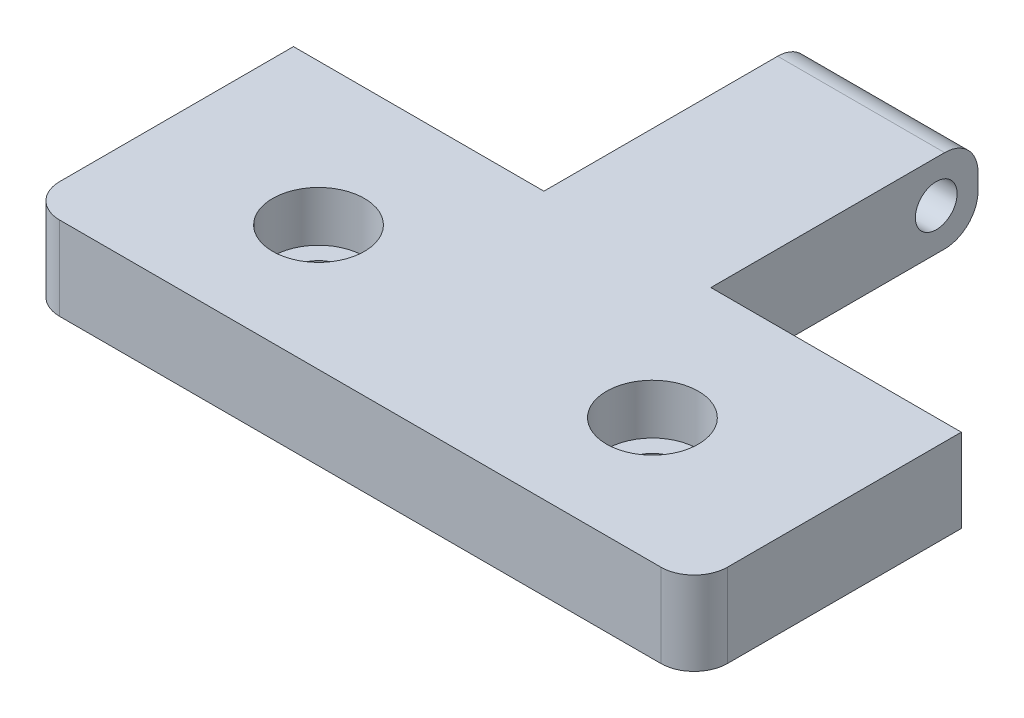
from build123d import *

# Parameters (mm, degrees)
EXTRUDE_1_DEPTH     = 10
FILLET_1_R          = 4
SKETCH_2_R          = 2.5
CUT_EXTRUDE_1_DEPTH = 82.829090182
FILLET_2_R          = 4
SKETCH_3_R          = 5.5
CUT_EXTRUDE_2_DEPTH = 6
SKETCH_4_R          = 3.25
CUT_EXTRUDE_3_DEPTH = 103.625532885


with BuildPart() as part:
    # 스케치1 → 보스-돌출1 (new body)
    with BuildSketch(Plane(origin=(0, 0, 0), x_dir=(1, 0, 0), z_dir=(0, 1, 0))):
        Polygon((50, 32), (80, 32), (80, 0), (0, 0), (0, 32), (30, 32), (30, 64), (50, 64), align=None)
    extrude(amount=EXTRUDE_1_DEPTH)

    # 필렛1
    fillet_1_edges = [part.edges().sort_by_distance(p)[0] for p in [
        (40, 10, -64),
        (40, 0, -64),
    ]]
    fillet(fillet_1_edges, radius=FILLET_1_R)

    # 스케치2 → 컷-돌출1 (cut, through all)
    with BuildSketch(Plane(origin=(50, 0, 0), x_dir=(0, 0, -1), z_dir=(1, 0, 0))):
        with Locations((59, 5)):
            Circle(SKETCH_2_R)
    extrude(amount=-CUT_EXTRUDE_1_DEPTH, mode=Mode.SUBTRACT)

    # 필렛2
    fillet_2_edges = [part.edges().sort_by_distance(p)[0] for p in [
        (80, 5, 0),
        (0, 5, 0),
    ]]
    fillet(fillet_2_edges, radius=FILLET_2_R)

    # 스케치3 → 컷-돌출2 (cut)
    with BuildSketch(Plane(origin=(0, 10, 0), x_dir=(1, 0, 0), z_dir=(0, 1, 0))):
        with Locations(Location((20, 15, 0), (0, 0, 270))):
            Circle(SKETCH_3_R)
        with Locations(Location((60, 15, 0), (0, 0, 270))):
            Circle(SKETCH_3_R)
    extrude(amount=-CUT_EXTRUDE_2_DEPTH, mode=Mode.SUBTRACT)

    # 스케치4 → 컷-돌출3 (cut, through all)
    with BuildSketch(Plane(origin=(0, 4, 0), x_dir=(1, 0, 0), z_dir=(0, 1, 0))):
        with Locations(Location((20, 15, 0), (0, 0, 270))):
            Circle(SKETCH_4_R)
        with Locations(Location((60, 15, 0), (0, 0, 270))):
            Circle(SKETCH_4_R)
    extrude(amount=-CUT_EXTRUDE_3_DEPTH, mode=Mode.SUBTRACT)


solid = part.part
